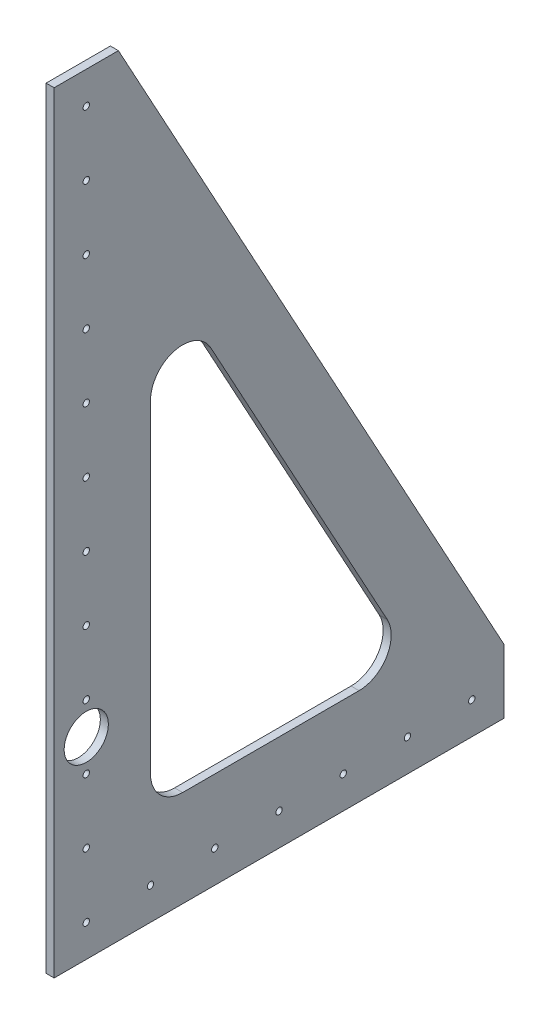
from build123d import *

# Parameters (mm, degrees)
BOSS_EXTRUDE1_DEPTH = 6.35
SKETCH2_R           = 17.4625
SKETCH2_R_2         = 2.54
CUT_EXTRUDE1_DEPTH  = 706.764721773


with BuildPart() as part:
    # Sketch1 → Boss-Extrude1 (new body)
    with BuildSketch(Plane(origin=(0, 0, 0), x_dir=(0, 0, -1), z_dir=(1, 0, 0))):
        Polygon((0, 0), (0, 609.6), (50.8, 609.6), (355.6, 50.8), (355.6, 0), align=None)
        with BuildLine():
            Line((76.2, 101.6), (76.2, 357.336122773))
            ThreePointArc((76.2, 357.336122773), (95.323978482, 381.948549591), (123.898547552, 369.498966892))
            Line((123.898547552, 369.498966892), (263.390978155, 113.762844119))
            ThreePointArc((263.390978155, 113.762844119), (262.933861882, 88.634203469), (241.092430603, 76.2))
            Line((241.092430603, 76.2), (101.6, 76.2))
            ThreePointArc((101.6, 76.2), (83.639487758, 83.639487758), (76.2, 101.6))
        make_face(mode=Mode.SUBTRACT)
    extrude(amount=BOSS_EXTRUDE1_DEPTH)

    # Sketch2 → Cut-Extrude1 (cut, through all)
    with BuildSketch(Plane(origin=(6.35, 0, 0), x_dir=(0, 0, -1), z_dir=(1, 0, 0))):
        with Locations((25.4, 152.4)):
            Circle(SKETCH2_R)
        with Locations((25.4, 25.4)):
            Circle(SKETCH2_R_2)
        with Locations((76.2, 25.4)):
            Circle(SKETCH2_R_2)
        with Locations((127, 25.4)):
            Circle(SKETCH2_R_2)
        with Locations((177.8, 25.4)):
            Circle(SKETCH2_R_2)
        with Locations((228.6, 25.4)):
            Circle(SKETCH2_R_2)
        with Locations((279.4, 25.4)):
            Circle(SKETCH2_R_2)
        with Locations((25.4, 76.2)):
            Circle(SKETCH2_R_2)
        with Locations((330.2, 25.4)):
            Circle(SKETCH2_R_2)
        with Locations((25.4, 127)):
            Circle(SKETCH2_R_2)
        with Locations((25.4, 177.8)):
            Circle(SKETCH2_R_2)
        with Locations((25.4, 228.6)):
            Circle(SKETCH2_R_2)
        with Locations((25.4, 279.4)):
            Circle(SKETCH2_R_2)
        with Locations((25.4, 330.2)):
            Circle(SKETCH2_R_2)
        with Locations((25.4, 381)):
            Circle(SKETCH2_R_2)
        with Locations((25.4, 431.8)):
            Circle(SKETCH2_R_2)
        with Locations((25.4, 482.6)):
            Circle(SKETCH2_R_2)
        with Locations((25.4, 533.4)):
            Circle(SKETCH2_R_2)
        with Locations((25.4, 584.2)):
            Circle(SKETCH2_R_2)
    extrude(amount=-CUT_EXTRUDE1_DEPTH, mode=Mode.SUBTRACT)


solid = part.part
